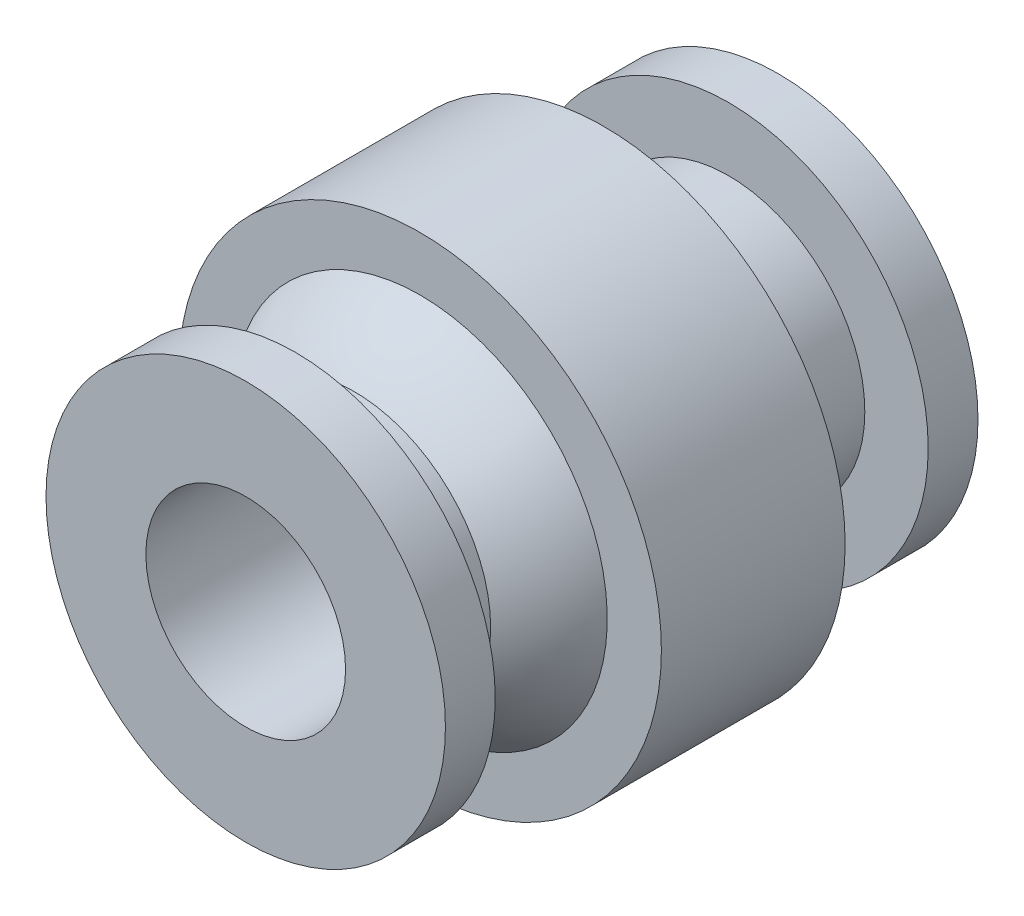
from build123d import *


with BuildPart() as part:
    # Sketch1 → Revolve1 (revolve)
    with BuildSketch(Plane(origin=(0, 0, 0), x_dir=(0, 0, -1), z_dir=(1, 0, 0)), mode=Mode.PRIVATE) as revolve1_sk:
        with BuildLine():
            Line((60.7949, -26.811732), (81.4451, -26.811732))
            Line((81.4451, -26.811732), (83.82, -26.811732))
            Line((83.82, -26.811732), (83.82, -31.574232))
            Line((83.82, -31.574232), (81.4451, -31.574232))
            Line((81.4451, -31.574232), (81.4451, -28.551632))
            Line((81.4451, -28.551632), (78.639993039, -28.551632))
            ThreePointArc((78.639993039, -28.551632), (77.1926569, -29.920339878), (75.5015, -30.973018125))
            Line((75.5015, -30.973018125), (75.5015, -33.555432))
            Line((75.5015, -33.555432), (66.7385, -33.555432))
            Line((66.7385, -33.555432), (66.7385, -30.973018125))
            ThreePointArc((66.7385, -30.973018125), (65.0473431, -29.920339878), (63.600006961, -28.551632))
            Line((63.600006961, -28.551632), (60.7949, -28.551632))
            Line((60.7949, -28.551632), (60.7949, -31.574232))
            Line((60.7949, -31.574232), (58.42, -31.574232))
            Line((58.42, -31.574232), (58.42, -26.811732))
            Line((58.42, -26.811732), (60.7949, -26.811732))
        make_face()
    revolve(revolve1_sk.sketch.rotate(Axis((0, -22.049232, -82.136173087), (0, 0, -1)), 270), axis=Axis((0, -22.049232, -82.136173087), (0, 0, -1)))


solid = part.part
